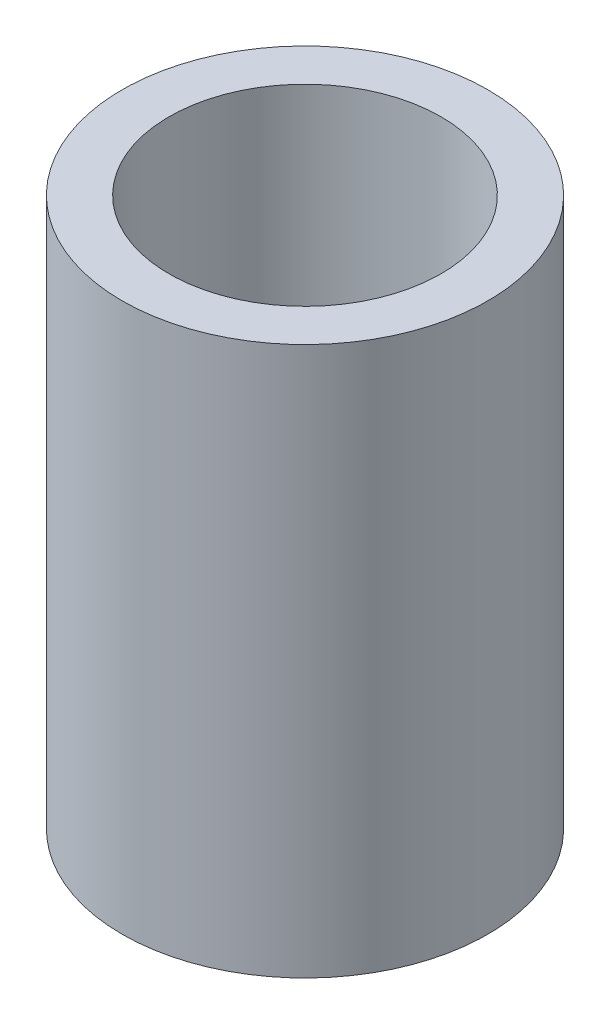
from build123d import *

# Parameters (mm, degrees)
SKETCH1_R           = 3.175
SKETCH1_R_2         = 2.3622
BOSS_EXTRUDE1_DEPTH = 9.525


with BuildPart() as part:
    # Sketch1 → Boss-Extrude1 (new body)
    with BuildSketch(Plane(origin=(0, 0, 0), x_dir=(1, 0, 0), z_dir=(0, 1, 0))):
        with Locations(Location((0, 0, 0), (0, 0, 90))):
            Circle(SKETCH1_R)
        with Locations(Location((0, 0, 0), (0, 0, 90))):
            Circle(SKETCH1_R_2, mode=Mode.SUBTRACT)
    extrude(amount=BOSS_EXTRUDE1_DEPTH)


solid = part.part
